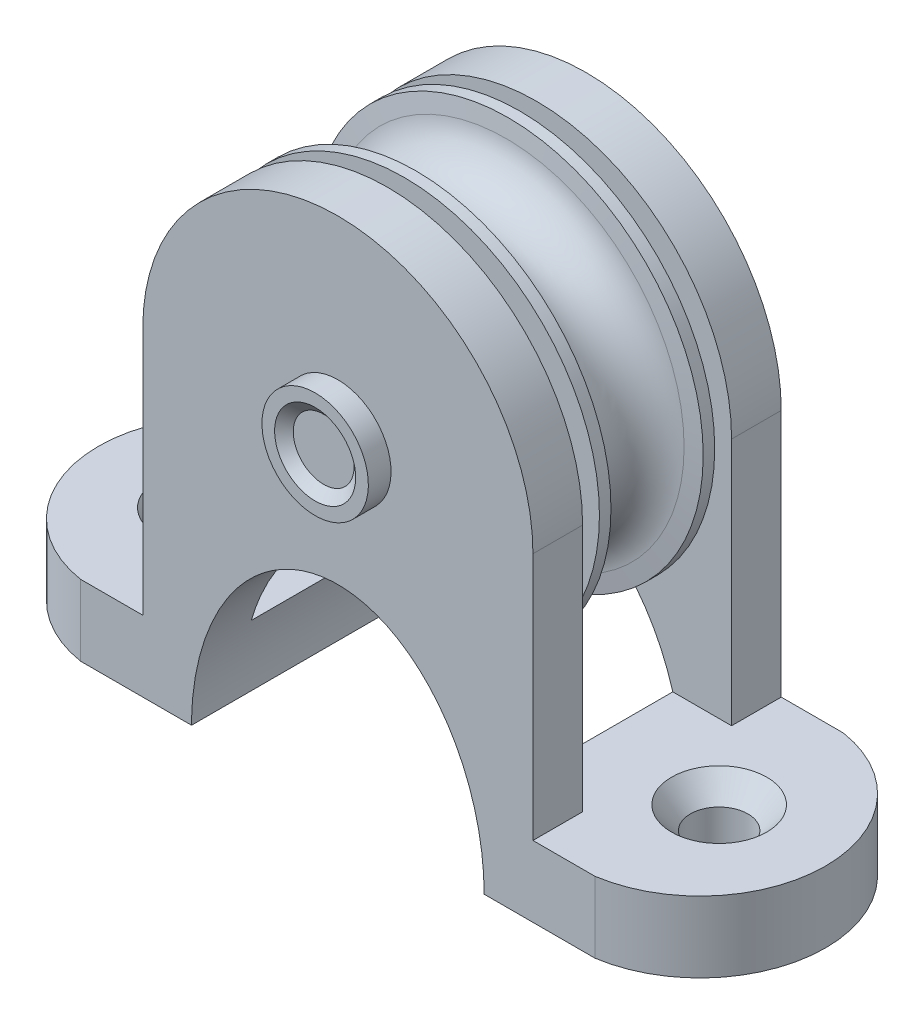
from build123d import *

# Parameters (mm, degrees)
SKETCH4_W                    = 65.0875
SKETCH4_H                    = 22.225
SKETCH4_R                    = 2.5781
BOSS_EXTRUDE1_DEPTH          = 6.35
SKETCH8_R                    = 2.5781
CUT_EXTRUDE2_DEPTH           = 2.0066
CUT_EXTRUDE2_DRAFT           = 40
CUT_EXTRUDE2_PROFILE_2_DEPTH = 2.0066
CUT_EXTRUDE2_PROFILE_2_DRAFT = 40
BOSS_EXTRUDE2_DEPTH          = 4.445
CUT_EXTRUDE1_DEPTH           = 46.564745685
CUT_EXTRUDE3_DEPTH           = 46.564745685
CUT_EXTRUDE3_DEPTH_BACK      = 46.564745685
SKETCH10_RX                  = 17.4625
SKETCH10_RY                  = 13.096875


with BuildPart() as part:
    # Sketch3 → Revolve1 (revolve)
    with BuildSketch(Plane(origin=(0, 0, 0), x_dir=(0, 0, -1), z_dir=(1, 0, 0)), mode=Mode.PRIVATE) as revolve1_sk:
        with BuildLine():
            Line((-5.159375, 17.4625), (-5.159375, 0))
            Line((-5.159375, 0), (5.159375, 0))
            Line((5.159375, 0), (5.159375, 17.4625))
            Line((5.159375, 17.4625), (4.1275, 17.4625))
            Line((4.1275, 17.4625), (3.938458344, 15.941214703))
            ThreePointArc((3.938458344, 15.941214703), (0, 12.461875), (-3.938458344, 15.941214703))
            Line((-3.938458344, 15.941214703), (-4.1275, 17.4625))
            Line((-4.1275, 17.4625), (-5.159375, 17.4625))
        make_face()
    revolve(revolve1_sk.sketch.rotate(Axis((0, 0, 5.159375), (0, 0, -1)), 90), axis=Axis((0, 0, 5.159375), (0, 0, -1)))

    # Sketch6 → Revolve2 (revolve)
    with BuildSketch(Plane(origin=(0, 0, 0), x_dir=(0, 0, -1), z_dir=(1, 0, 0))):
        with BuildLine():
            Line((-11.1125, 3.175), (11.1125, 3.175))
            Line((11.1125, 3.175), (11.1125, 5.55625))
            Line((11.1125, 5.55625), (11.8745, 5.55625))
            ThreePointArc((11.8745, 5.55625), (13.566668214, 3.004068494), (14.1605, 0))
            Line((14.1605, 0), (-12.3825, 0))
            Line((-12.3825, 0), (-12.3825, 2.720941881))
            Line((-12.3825, 2.720941881), (-13.1445, 3.629058119))
            Line((-13.1445, 3.629058119), (-13.1445, 4.7625))
            Line((-13.1445, 4.7625), (-11.1125, 4.7625))
            Line((-11.1125, 4.7625), (-11.1125, 3.175))
        make_face()
    revolve(axis=Axis((0, 0, -14.1605), (0, 0, 1)))


with BuildPart() as body_2:
    # Sketch4 → Boss-Extrude1 (new body)
    with BuildSketch(Plane(origin=(0, -28.575, 0), x_dir=(-1, 0, 0), z_dir=(0, 1, 0))):
        Rectangle(SKETCH4_W, SKETCH4_H)
        with Locations(Location((23.01875, 0, 0), (0, 0, 90))):
            Circle(SKETCH4_R, mode=Mode.SUBTRACT)
        with Locations(Location((-23.01875, 0, 0), (0, 0, 90))):
            Circle(SKETCH4_R, mode=Mode.SUBTRACT)
    extrude(amount=BOSS_EXTRUDE1_DEPTH)


with BuildPart() as cut_extrude2_tool:
    # Sketch8 → Cut-Extrude2 (with draft: the straight prism first)
    with BuildSketch(Plane.XZ.offset(24.2316)):
        with Locations(Location((23.01875, 0, 0), (0, 0, 270))):
            Circle(SKETCH8_R)
    extrude(amount=-CUT_EXTRUDE2_DEPTH)
    # Cut-Extrude2: the draft: its side faces are tilted about the plane it starts from
    cut_extrude2_sides = [cut_extrude2_tool.faces().sort_by_distance(p)[0] for p in [
        (23.01875, -23.2283, 2.5781),
    ]]
    draft(cut_extrude2_sides, Plane.XZ.offset(24.2316), CUT_EXTRUDE2_DRAFT)


with BuildPart() as body_2_1:
    add(body_2.part)

    # Cut-Extrude2: cut by cut_extrude2_tool
    add(cut_extrude2_tool.part, mode=Mode.SUBTRACT)


with BuildPart() as cut_extrude2_profile_2_tool:
    # Sketch8 → Cut-Extrude2 profile 2 (with draft: the straight prism first)
    with BuildSketch(Plane.XZ.offset(24.2316)):
        with Locations(Location((-23.01875, 0, 0), (0, 0, 270))):
            Circle(SKETCH8_R)
    extrude(amount=-CUT_EXTRUDE2_PROFILE_2_DEPTH)
    # Cut-Extrude2 profile 2: the draft: its side faces are tilted about the plane it starts from
    cut_extrude2_profile_2_sides = [cut_extrude2_profile_2_tool.faces().sort_by_distance(p)[0] for p in [
        (-23.01875, -23.2283, 2.5781),
    ]]
    draft(cut_extrude2_profile_2_sides, Plane.XZ.offset(24.2316), CUT_EXTRUDE2_PROFILE_2_DRAFT)


with BuildPart() as body_2_2:
    add(body_2_1.part)

    # Cut-Extrude2 profile 2: cut by cut_extrude2_profile_2_tool
    add(cut_extrude2_profile_2_tool.part, mode=Mode.SUBTRACT)

    # Sketch5 → Boss-Extrude2 (add)
    with BuildSketch(Plane.XY.offset(11.1125)):
        with BuildLine():
            Line((-17.4625, 0), (-17.4625, -22.225))
            Line((-17.4625, -22.225), (17.4625, -22.225))
            Line((17.4625, -22.225), (17.4625, 0))
            ThreePointArc((17.4625, 0), (0, 17.4625), (-17.4625, 0))
        make_face()
    boss_extrude2 = extrude(amount=-BOSS_EXTRUDE2_DEPTH)

    # Mirror1: Boss-Extrude2 across plane
    add(boss_extrude2.mirror(Plane.XY))

    # Sketch7 → Cut-Extrude1 (cut, through all)
    with BuildSketch(Plane(origin=(0, 0, 0), x_dir=(1, 0, 0), z_dir=(0, 1, 0))):
        with BuildLine():
            Line((-23.01875, 11.1125), (-23.01875, 11.7475))
            Line((-23.01875, 11.7475), (-33.17875, 11.7475))
            Line((-33.17875, 11.7475), (-33.17875, -11.7475))
            Line((-33.17875, -11.7475), (-23.01875, -11.7475))
            Line((-23.01875, -11.7475), (-23.01875, -11.1125))
            ThreePointArc((-23.01875, -11.1125), (-32.54375, 0), (-23.01875, 11.1125))
        make_face()
        with BuildLine():
            Line((23.01875, -11.7475), (33.17875, -11.7475))
            Line((33.17875, -11.7475), (33.17875, 11.7475))
            Line((33.17875, 11.7475), (23.01875, 11.7475))
            Line((23.01875, 11.7475), (23.01875, 11.1125))
            ThreePointArc((23.01875, 11.1125), (32.54375, 0), (23.01875, -11.1125))
            Line((23.01875, -11.1125), (23.01875, -11.7475))
        make_face()
    extrude(amount=-CUT_EXTRUDE1_DEPTH, mode=Mode.SUBTRACT)

    # Sketch10 → Cut-Extrude3 (cut, two sides: drawn at the far end of the back side and taken through both)
    with BuildSketch(Plane.XY.offset(-CUT_EXTRUDE3_DEPTH_BACK)):
        with Locations(Location((0, -28.575), (0, 0, -90))):
            Ellipse(SKETCH10_RX, SKETCH10_RY)
    extrude(amount=CUT_EXTRUDE3_DEPTH + CUT_EXTRUDE3_DEPTH_BACK, mode=Mode.SUBTRACT)


solid = Compound([part.part, body_2_2.part])
